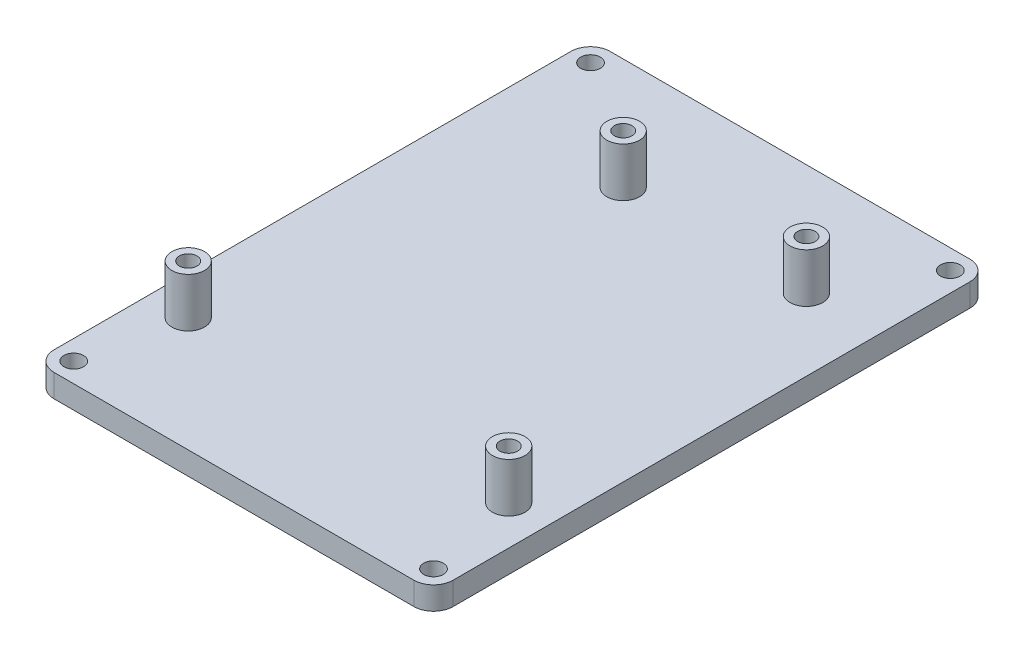
from build123d import *

# Parameters (mm, degrees)
SKETCH1_W           = 61
SKETCH1_H           = 85
BOSS_EXTRUDE1_DEPTH = 3.5
SKETCH2_R           = 1.5
CUT_EXTRUDE1_DEPTH  = 3.5
SKETCH3_R           = 2.5
BOSS_EXTRUDE2_DEPTH = 7.5
SKETCH4_R           = 1.35
CUT_EXTRUDE2_DEPTH  = 7.5
FILLET1_R           = 3


with BuildPart() as part:
    # Sketch1 → Boss-Extrude1 (new body)
    with BuildSketch(Plane(origin=(0, 0, 0), x_dir=(1, 0, 0), z_dir=(0, 1, 0))):
        Rectangle(SKETCH1_W, SKETCH1_H)
    extrude(amount=BOSS_EXTRUDE1_DEPTH)

    # Sketch2 → Cut-Extrude1 (cut)
    with BuildSketch(Plane(origin=(0, 3.5, 0), x_dir=(1, 0, 0), z_dir=(0, 1, 0))):
        with Locations(Location((-27.5, 39.5, 0), (0, 0, 270))):
            Circle(SKETCH2_R)
        with Locations(Location((27.5, 39.5, 0), (0, 0, 270))):
            Circle(SKETCH2_R)
        with Locations(Location((-27.5, -39.5, 0), (0, 0, 270))):
            Circle(SKETCH2_R)
        with Locations(Location((27.5, -39.5, 0), (0, 0, 270))):
            Circle(SKETCH2_R)
    extrude(amount=-CUT_EXTRUDE1_DEPTH, mode=Mode.SUBTRACT)

    # Sketch3 → Boss-Extrude2 (add)
    with BuildSketch(Plane(origin=(0, 3.5, 0), x_dir=(1, 0, 0), z_dir=(0, 1, 0))):
        with Locations(Location((-24.5, -25, 0), (0, 0, 270))):
            Circle(SKETCH3_R)
        with Locations(Location((24.5, -25, 0), (0, 0, 270))):
            Circle(SKETCH3_R)
        with Locations(Location((19.5, 25.5, 0), (0, 0, 270))):
            Circle(SKETCH3_R)
        with Locations(Location((-8.5, 25.5, 0), (0, 0, 270))):
            Circle(SKETCH3_R)
    extrude(amount=BOSS_EXTRUDE2_DEPTH)

    # Sketch4 → Cut-Extrude2 (cut)
    with BuildSketch(Plane(origin=(0, 11, 0), x_dir=(1, 0, 0), z_dir=(0, 1, 0))):
        with Locations(Location((-8.5, 25.5, 0), (0, 0, 270))):
            Circle(SKETCH4_R)
        with Locations(Location((19.5, 25.5, 0), (0, 0, 270))):
            Circle(SKETCH4_R)
        with Locations(Location((-24.5, -25, 0), (0, 0, 270))):
            Circle(SKETCH4_R)
        with Locations(Location((24.5, -25, 0), (0, 0, 270))):
            Circle(SKETCH4_R)
    extrude(amount=-CUT_EXTRUDE2_DEPTH, mode=Mode.SUBTRACT)

    # Fillet1
    fillet1_edges = [part.edges().sort_by_distance(p)[0] for p in [
        (30.5, 1.75, 42.5),
        (-30.5, 1.75, 42.5),
        (-30.5, 1.75, -42.5),
        (30.5, 1.75, -42.5),
    ]]
    fillet(fillet1_edges, radius=FILLET1_R)


solid = part.part
